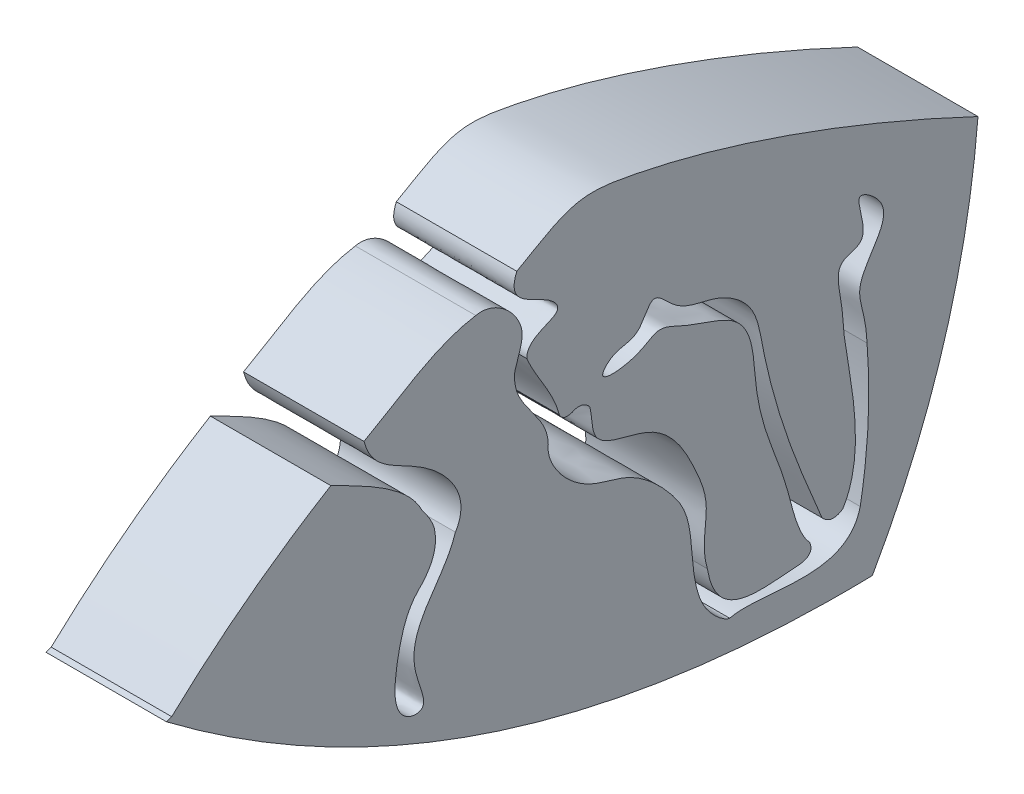
from build123d import *

# Parameters (mm, degrees)
BOSS_EXTRUDE1_DEPTH = 10


with BuildPart() as part:
    # Sketch1 → Boss-Extrude1 (new body)
    with BuildSketch(Plane(origin=(0, 0, 0), x_dir=(0, 0, -1), z_dir=(1, 0, 0))):
        with BuildLine():
            add(Edge.make_bspline(
                [(-32.616166955, -0.153767482), (-32.410233376, -0.089269145), (-32.184437288, 0)],
                knots=[0.917721423, 0.917721423, 0.917721423, 1, 1, 1], degree=2))
            add(Edge.make_bspline(
                [(-32.616166955, -0.153767482), (-6.707241591, -19.679410057), (25.98172436, -18.940485095)],
                knots=[0.03955994, 0.03955994, 0.03955994, 1, 1, 1], degree=2))
            add(Edge.make_bspline(
                [(34.750139425, 9.675257924), (33.434419406, -5.858441338), (25.98172436, -18.940485095)],
                knots=[0.040845076, 0.040845076, 0.040845076, 1, 1, 1], degree=2))
            add(Edge.make_bspline(
                [(34.750139425, 9.675257924), (28.582825389, 12.599456277), (18.774883381, 16.637587442), (7.763545936, 19.59173258), (1.018008589, 20.67127134), (-1.771374038, 18.659105751), (-3.535773438, 17.695000564)],
                knots=[0.002600207, 0.002600207, 0.002600207, 0.002600207, 0.479063297, 0.70739725, 0.794305452, 0.928423254, 0.928423254, 0.928423254, 0.928423254], degree=3))
            add(Edge.make_bspline(
                [(-3.535773438, 17.695000564), (-4.529645367, 15.346862551), (-1.145875463, 15.099836406), (0.483184414, 12.718462722), (-2.755184122, 12.358625571), (-2.708550132, 11.002691644)],
                knots=[0, 0, 0, 0, 0.202924405, 0.262155305, 0.366680458, 0.366680458, 0.366680458, 0.366680458], degree=3))
            add(Edge.make_bspline(
                [(0, 5.607076944), (-0.510499577, 7.604704852), (-1.922410174, 9.142802275), (-2.708550132, 11.002691644)],
                knots=[0, 0, 0, 0, 1, 1, 1, 1], degree=3))
            add(Edge.make_bspline(
                [(1.356998428, 5.370055993), (0.563557671, 5.010897248), (0.218015253, 5.209568957), (0, 5.607076944)],
                knots=[0.064158532, 0.064158532, 0.064158532, 0.064158532, 0.43671099, 0.43671099, 0.43671099, 0.43671099], degree=3))
            add(Edge.make_bspline(
                [(2.50940923, 4.943498592), (2.030031314, 5.511227017), (1.356998428, 5.370055993)],
                knots=[0, 0, 0, 1, 1, 1], degree=2))
            add(Edge.make_bspline(
                [(12.282708466, -11.602105568), (11.716990302, -9.685895855), (12.685226202, -7.324534068), (10.958156644, -3.072234886), (8.587135946, 1.251163489), (2.449830365, 1.472366858), (2.731341272, 4.273759907), (2.50940923, 4.943498592)],
                knots=[0, 0, 0, 0, 0.083393647, 0.137741817, 0.243698106, 0.320985704, 0.364890338, 0.364890338, 0.364890338, 0.364890338], degree=3))
            add(Edge.make_bspline(
                [(12.282708466, -11.602105568), (13.056317233, -16.354499909), (17.062690995, -15.242216766), (19.94930479, -15.119898595)],
                knots=[0, 0, 0, 0, 0.609650355, 0.609650355, 0.609650355, 0.609650355], degree=3))
            add(Edge.make_bspline(
                [(20.771311412, -13.944151681), (21.196197032, -14.942883665), (19.94930479, -15.119898595)],
                knots=[0, 0, 0, 1, 1, 1], degree=2))
            add(Edge.make_bspline(
                [(21.803515053, -12.701236846), (21.510424659, -11.979324037), (20.086979085, -8.609950032), (18.548891304, -4.636602207), (16.998993569, 0.889518799), (16.328077147, 5.566541982), (13.062924367, 7.8416029), (9.885102551, 7.944829381), (7.677312717, 10.906141675), (6.662605482, 7.687100186), (4.676883881, 8.083433161), (2.784004562, 6.060867849), (6.52825957, 6.414851665), (8.263222162, 8.00060639), (10.541070791, 6.551204394), (16.1298206, 5.201755859), (16.050202751, -0.088853464), (17.080318262, -4.372966621), (19.002010111, -8.82348124), (19.751837022, -12.845238022), (20.771311412, -13.944151681)],
                knots=[0.043284236, 0.043284236, 0.043284236, 0.043284236, 0.070187917, 0.157911966, 0.259538077, 0.309961506, 0.369972377, 0.42125757, 0.450240621, 0.480238183, 0.514104211, 0.52894326, 0.5704914, 0.596433072, 0.632481793, 0.677832483, 0.763885266, 0.843044692, 0.900044622, 0.955273514, 0.955273514, 0.955273514, 0.955273514], degree=3))
            add(Edge.make_bspline(
                [(23.523290907, -12.920477779), (22.585123871, -13.55230509), (21.803515053, -12.701236846)],
                knots=[0, 0, 0, 1, 1, 1], degree=2))
            add(Edge.make_bspline(
                [(23.649364418, -0.570525066), (24.038851296, -3.662404668), (25.59817464, -9.640031528), (23.523290907, -12.920477779)],
                knots=[0, 0, 0, 0, 0.825093396, 0.825093396, 0.825093396, 0.825093396], degree=3))
            add(Edge.make_bspline(
                [(25.539093083, -2.001333882), (25.526627177, -1.571867968), (25.313121334, 0.473862866), (24.508395318, 2.095714393), (26.134367038, 4.674000364), (27.742397109, 7.169970905), (23.781144363, 10.051173631), (26.225512577, 5.23872232), (22.769812951, 5.130369279), (23.475539458, 2.008125517), (23.57347437, 0.405107856), (23.649364418, -0.570525066)],
                knots=[0.103532678, 0.103532678, 0.103532678, 0.103532678, 0.137224645, 0.252241445, 0.335792351, 0.453099394, 0.531648935, 0.649934222, 0.712249546, 0.803022393, 0.912855442, 0.912855442, 0.912855442, 0.912855442], degree=3))
            add(Edge.make_bspline(
                [(25.539093083, -2.001333882), (25.851893908, -5.860677805), (25.66324164, -9.683366178), (24.973136277, -13.469399001)],
                knots=[0.101180343, 0.101180343, 0.101180343, 0.101180343, 1, 1, 1, 1], degree=3))
            add(Edge.make_bspline(
                [(14.130814382, -16.077566847), (17.00971518, -15.406986529), (23.863120783, -17.973844454), (24.973136277, -13.469399001)],
                knots=[0, 0, 0, 0, 1, 1, 1, 1], degree=3))
            add(Edge.make_bspline(
                [(-0.92226419, 3.943376594), (-0.988951357, 3.466008935), (-0.4798402, 1.57243922), (2.268596076, -0.96086022), (6.195911145, -1.436403565), (10.150990153, -5.397471193), (11.018465658, -7.938917569), (11.180951229, -14.119753728), (13.741997636, -16.056247168), (14.130814382, -16.077566847)],
                knots=[0.440867396, 0.440867396, 0.440867396, 0.440867396, 0.467019237, 0.535882153, 0.597257596, 0.688483693, 0.789269143, 0.864221741, 0.91256564, 0.91256564, 0.91256564, 0.91256564], degree=3))
            add(Edge.make_bspline(
                [(-0.92226419, 3.943376594), (-0.996988295, 6.55010994), (-4.012529952, 7.766485057), (-3.698718287, 10.582881811)],
                knots=[0, 0, 0, 0, 1, 1, 1, 1], degree=3))
            add(Edge.make_bspline(
                [(-3.698718287, 10.582881811), (-3.388671505, 11.677757377), (-2.257626148, 13.652798056), (-5.284923516, 16.574020194), (-6.938863358, 16.218070209)],
                knots=[0.684063311, 0.684063311, 0.684063311, 0.684063311, 0.804597566, 1, 1, 1, 1], degree=3))
            add(Edge.make_bspline(
                [(-16.218391409, 11.806193211), (-12.977563245, 13.606854446), (-10.331631009, 15.679135304), (-6.938863358, 16.218070209)],
                knots=[0.635290826, 0.635290826, 0.635290826, 0.635290826, 1, 1, 1, 1], degree=3))
            add(Edge.make_bspline(
                [(-16.218391409, 11.806193211), (-15.555317991, 9.228663677), (-11.488640598, 8.509598456), (-7.495401086, 4.029593828), (-8.455964772, 1.755663962), (-8.630107718, 1.489111276)],
                knots=[0, 0, 0, 0, 0.374967464, 0.716088331, 0.771728532, 0.771728532, 0.771728532, 0.771728532], degree=3))
            add(Edge.make_bspline(
                [(-8.630107718, 1.489111276), (-9.570536539, -1.527078585), (-13.642140839, -3.912228848), (-10.746445661, -9.864109982), (-12.558918483, -10.116697337), (-13.887746644, -8.678022289), (-13.445706454, -4.779482618), (-12.53632714, -1.764616784), (-11.239397579, -0.735598583), (-10.939711438, -0.246964835)],
                knots=[0, 0, 0, 0, 0.334755607, 0.434437649, 0.507607284, 0.625275321, 0.74821706, 0.885473894, 0.947564925, 0.947564925, 0.947564925, 0.947564925], degree=3))
            add(Edge.make_bspline(
                [(-10.39771491, 2.720324846), (-10.015843658, 1.115294553), (-10.939711438, -0.246964835)],
                knots=[0, 0, 0, 1, 1, 1], degree=2))
            add(Edge.make_bspline(
                [(-10.39771491, 2.720324846), (-10.6553486, 3.506871833), (-11.39550241, 4.425256324)],
                knots=[0.955385123, 0.955385123, 0.955385123, 1, 1, 1], degree=2))
            add(Edge.make_bspline(
                [(-11.39550241, 4.425256324), (-12.63842769, 7.058259393), (-16.782877709, 8.869409421), (-18.972167488, 10.002617311)],
                knots=[0.545737143, 0.545737143, 0.545737143, 0.545737143, 1, 1, 1, 1], degree=3))
            add(Edge.make_bspline(
                [(-32.184437288, 0), (-26.242754622, 5.597848633), (-18.972167488, 10.002617311)],
                knots=[0, 0, 0, 0.556811649, 0.556811649, 0.556811649], degree=2))
        make_face()
    extrude(amount=BOSS_EXTRUDE1_DEPTH)


solid = part.part
